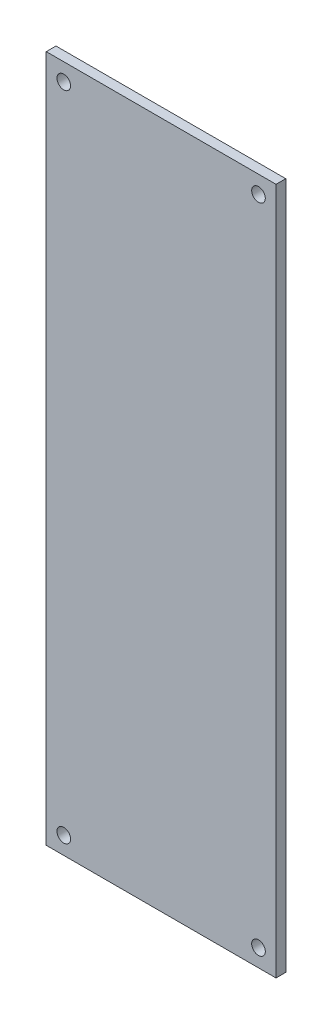
from build123d import *

# Parameters (mm, degrees)
SKETCH_1_W          = 118
SKETCH_1_H          = 353
EXTRUDE_1_DEPTH     = 5
SKETCH_2_R          = 3.5
CUT_EXTRUDE_1_DEPTH = 5


with BuildPart() as part:
    # 草图1 → 凸台-拉伸1 (new body)
    with BuildSketch(Plane.XY):
        Rectangle(SKETCH_1_W, SKETCH_1_H)
    extrude(amount=EXTRUDE_1_DEPTH)

    # 草图2 → 切除-拉伸1 (cut)
    with BuildSketch(Plane.XY.offset(5)):
        with Locations((-50, 167.5)):
            Circle(SKETCH_2_R)
        with Locations(Location((50, 167.5, 0), (0, 0, 180))):
            Circle(SKETCH_2_R)
        with Locations((50, -167.5)):
            Circle(SKETCH_2_R)
        with Locations(Location((-50, -167.5, 0), (0, 0, 180))):
            Circle(SKETCH_2_R)
    extrude(amount=-CUT_EXTRUDE_1_DEPTH, mode=Mode.SUBTRACT)


solid = part.part
